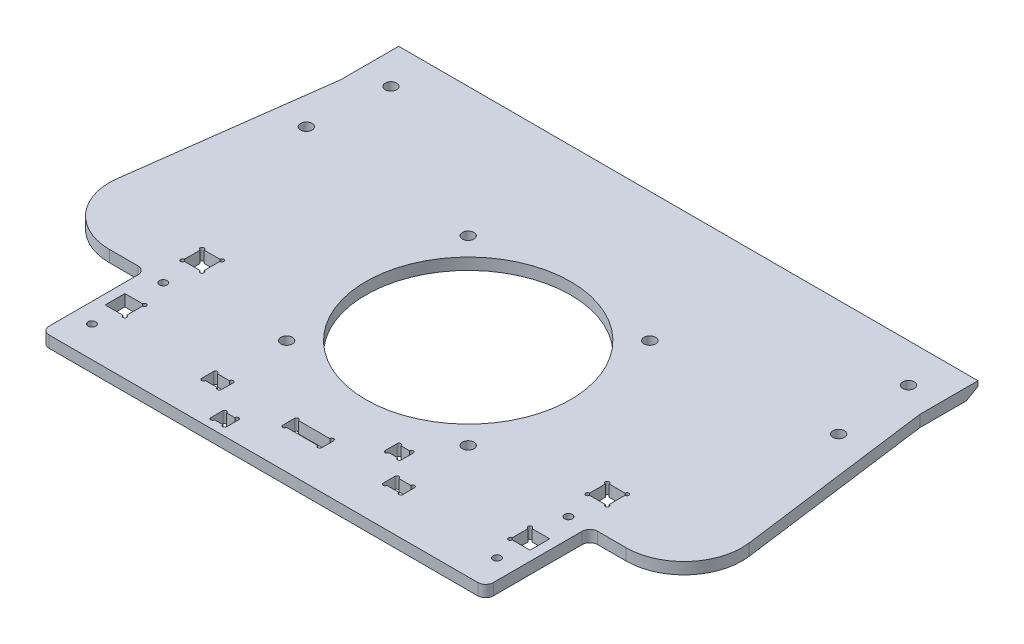
from build123d import *

# Parameters (mm, degrees)
SKETCH1_W           = 5.1
SKETCH1_H           = 5.1
BOSS_EXTRUDE1_DEPTH = 3
SKETCH2_R           = 26.5
SKETCH2_R_2         = 1.5
CUT_EXTRUDE1_DEPTH  = 3
FILLET1_R           = 15
SKETCH7_W           = 4.1
SKETCH7_H           = 3.1
SKETCH7_W_2         = 4.2
SKETCH7_W_3         = 5.1
SKETCH7_W_4         = 10.1
CUT_EXTRUDE4_DEPTH  = 10
CHAMFER1_SIZE       = 3
CHAMFER1_SIZE2      = 1.732050808
CUT_EXTRUDE5_DEPTH  = 10
SKETCH9_R           = 1
SKETCH9_R_2         = 1.5
CUT_EXTRUDE6_DEPTH  = 10
FILLET3_R           = 2


with BuildPart() as part:
    # Sketch1 → Boss-Extrude1 (new body)
    with BuildSketch(Plane(origin=(0, 0, 0), x_dir=(1, 0, 0), z_dir=(0, 1, 0))):
        Polygon((75, 95), (75, 110), (-75, 110), (-75, 95), (-84, 27), (-57.5, 27), (-57.5, 19.1), (-57.5, 14), (-57.5, 0), (57.5, 0), (57.5, 14), (57.5, 19.1), (57.5, 27), (84, 27), align=None)
        with Locations((52.45, 16.55)):
            Rectangle(SKETCH1_W, SKETCH1_H, mode=Mode.SUBTRACT)
        with Locations((52.45, 36.55)):
            Rectangle(SKETCH1_W, SKETCH1_H, mode=Mode.SUBTRACT)
        with Locations((-52.45, 16.55)):
            Rectangle(SKETCH1_W, SKETCH1_H, mode=Mode.SUBTRACT)
        with Locations((-52.45, 36.55)):
            Rectangle(SKETCH1_W, SKETCH1_H, mode=Mode.SUBTRACT)
    extrude(amount=BOSS_EXTRUDE1_DEPTH)

    # Sketch2 → Cut-Extrude1 (cut)
    with BuildSketch(Plane(origin=(0, 3, 0), x_dir=(1, 0, 0), z_dir=(0, 1, 0))):
        with Locations(Location((0, 53, 0), (0, 0, 270))):
            Circle(SKETCH2_R)
        with Locations(Location((23.511300474, 76.511300474, 0), (0, 0, 270))):
            Circle(SKETCH2_R_2)
        with Locations(Location((-23.511300474, 76.511300474, 0), (0, 0, 270))):
            Circle(SKETCH2_R_2)
        with Locations(Location((-23.511300474, 29.488699526, 0), (0, 0, 270))):
            Circle(SKETCH2_R_2)
        with Locations(Location((23.511300474, 29.488699526, 0), (0, 0, 270))):
            Circle(SKETCH2_R_2)
    extrude(amount=-CUT_EXTRUDE1_DEPTH, mode=Mode.SUBTRACT)

    # Fillet1
    fillet1_edges = [part.edges().sort_by_distance(p)[0] for p in [
        (-84, 1.5, -27),
        (84, 1.5, -27),
    ]]
    fillet(fillet1_edges, radius=FILLET1_R)

    # Sketch7 → Cut-Extrude4 (cut)
    with BuildSketch(Plane.XZ):
        with Locations((-14, -3.95)):
            Rectangle(SKETCH7_W, SKETCH7_H)
        with Locations((16, -19.15)):
            Rectangle(SKETCH7_W_2, SKETCH7_H)
        with Locations((-23.5, -11.55)):
            Rectangle(SKETCH7_W_3, SKETCH7_H)
        with Locations((23.5, -11.55)):
            Rectangle(SKETCH7_W_3, SKETCH7_H)
        with Locations((0, -11.55)):
            Rectangle(SKETCH7_W_4, SKETCH7_H)
    extrude(amount=-CUT_EXTRUDE4_DEPTH, mode=Mode.SUBTRACT)

    # Chamfer1
    chamfer1_edges = [part.edges().sort_by_distance(p)[0] for p in [
        (0, 0, -110),
    ]]
    chamfer1_side = [part.faces().sort_by_distance(p)[0] for p in [
        (76.421351958, 0, -69.225215197),
    ]]
    chamfer(chamfer1_edges, length=CHAMFER1_SIZE, length2=CHAMFER1_SIZE2, reference=chamfer1_side[0])

    # Sketch4 → Cut-Extrude5 (cut)
    with BuildSketch(Plane(origin=(0, 3, 0), x_dir=(1, 0, 0), z_dir=(0, 1, 0))):
        with BuildLine():
            Line((50.4, 39.1), (49.9, 39.1))
            Line((49.9, 39.1), (49.9, 38.6))
            ThreePointArc((49.9, 38.6), (49.546446609, 39.453553391), (50.4, 39.1))
        make_face()
        with BuildLine():
            ThreePointArc((54.5, 39.1), (55.353553391, 39.453553391), (55, 38.6))
            Line((55, 38.6), (55, 39.1))
            Line((55, 39.1), (54.5, 39.1))
        make_face()
        with BuildLine():
            ThreePointArc((55, 34.5), (55.353553391, 33.646446609), (54.5, 34))
            Line((54.5, 34), (55, 34))
            Line((55, 34), (55, 34.5))
        make_face()
        with BuildLine():
            Line((49.9, 34.5), (49.9, 34))
            Line((49.9, 34), (50.4, 34))
            ThreePointArc((50.4, 34), (49.546446609, 33.646446609), (49.9, 34.5))
        make_face()
        with BuildLine():
            Line((49.9, 19.1), (49.9, 18.6))
            ThreePointArc((49.9, 18.6), (49.546446609, 19.453553391), (50.4, 19.1))
            Line((50.4, 19.1), (49.9, 19.1))
        make_face()
        with BuildLine():
            ThreePointArc((49.9, 14.5), (49.546446609, 13.646446609), (50.4, 14))
            Line((50.4, 14), (49.9, 14))
            Line((49.9, 14), (49.9, 14.5))
        make_face()
        with BuildLine():
            ThreePointArc((13.9, 20.7), (14.4, 21.2), (14.9, 20.7))
            Line((14.9, 20.7), (13.9, 20.7))
        make_face()
        with BuildLine():
            ThreePointArc((18.1, 20.7), (17.6, 21.2), (17.1, 20.7))
            Line((17.1, 20.7), (18.1, 20.7))
        make_face()
        with BuildLine():
            ThreePointArc((18.1, 17.6), (17.6, 17.1), (17.1, 17.6))
            Line((17.1, 17.6), (18.1, 17.6))
        make_face()
        with BuildLine():
            ThreePointArc((13.9, 17.6), (14.4, 17.1), (14.9, 17.6))
            Line((14.9, 17.6), (13.9, 17.6))
        make_face()
        with BuildLine():
            ThreePointArc((20.95, 13.1), (21.45, 13.6), (21.95, 13.1))
            Line((21.95, 13.1), (20.95, 13.1))
        make_face()
        with BuildLine():
            ThreePointArc((26.05, 13.1), (25.55, 13.6), (25.05, 13.1))
            Line((25.05, 13.1), (26.05, 13.1))
        make_face()
        with BuildLine():
            ThreePointArc((26.05, 10), (25.55, 9.5), (25.05, 10))
            Line((25.05, 10), (26.05, 10))
        make_face()
        with BuildLine():
            ThreePointArc((20.95, 10), (21.45, 9.5), (21.95, 10))
            Line((21.95, 10), (20.95, 10))
        make_face()
        with BuildLine():
            ThreePointArc((5.05, 13.1), (4.55, 13.6), (4.05, 13.1))
            Line((4.05, 13.1), (5.05, 13.1))
        make_face()
        with BuildLine():
            ThreePointArc((5.05, 10), (4.55, 9.5), (4.05, 10))
            Line((4.05, 10), (5.05, 10))
        make_face()
        with BuildLine():
            ThreePointArc((-5.05, 13.1), (-4.55, 13.6), (-4.05, 13.1))
            Line((-4.05, 13.1), (-5.05, 13.1))
        make_face()
        with BuildLine():
            ThreePointArc((-5.05, 10), (-4.55, 9.5), (-4.05, 10))
            Line((-4.05, 10), (-5.05, 10))
        make_face()
        with BuildLine():
            ThreePointArc((-11.95, 5.5), (-12.45, 6), (-12.95, 5.5))
            Line((-12.95, 5.5), (-11.95, 5.5))
        make_face()
        with BuildLine():
            ThreePointArc((-11.95, 2.4), (-12.45, 1.9), (-12.95, 2.4))
            Line((-12.95, 2.4), (-11.95, 2.4))
        make_face()
        with BuildLine():
            ThreePointArc((-16.05, 2.4), (-15.55, 1.9), (-15.05, 2.4))
            Line((-15.05, 2.4), (-16.05, 2.4))
        make_face()
        with BuildLine():
            ThreePointArc((-16.05, 5.5), (-15.55, 6), (-15.05, 5.5))
            Line((-15.05, 5.5), (-16.05, 5.5))
        make_face()
        with BuildLine():
            ThreePointArc((-20.95, 10), (-21.45, 9.5), (-21.95, 10))
            Line((-21.95, 10), (-20.95, 10))
        make_face()
        with BuildLine():
            ThreePointArc((-20.95, 13.1), (-21.45, 13.6), (-21.95, 13.1))
            Line((-21.95, 13.1), (-20.95, 13.1))
        make_face()
        with BuildLine():
            ThreePointArc((-26.05, 13.1), (-25.55, 13.6), (-25.05, 13.1))
            Line((-25.05, 13.1), (-26.05, 13.1))
        make_face()
        with BuildLine():
            ThreePointArc((-26.05, 10), (-25.55, 9.5), (-25.05, 10))
            Line((-25.05, 10), (-26.05, 10))
        make_face()
        with BuildLine():
            Line((-49.9, 19.1), (-49.9, 18.6))
            ThreePointArc((-49.9, 18.6), (-49.546446609, 19.453553391), (-50.4, 19.1))
            Line((-50.4, 19.1), (-49.9, 19.1))
        make_face()
        with BuildLine():
            ThreePointArc((-49.9, 14.5), (-49.546446609, 13.646446609), (-50.4, 14))
            Line((-50.4, 14), (-49.9, 14))
            Line((-49.9, 14), (-49.9, 14.5))
        make_face()
        with BuildLine():
            ThreePointArc((-50.4, 39.1), (-49.546446609, 39.453553391), (-49.9, 38.6))
            Line((-49.9, 38.6), (-49.9, 39.1))
            Line((-49.9, 39.1), (-50.4, 39.1))
        make_face()
        with BuildLine():
            Line((-49.9, 34), (-50.4, 34))
            ThreePointArc((-50.4, 34), (-49.546446609, 33.646446609), (-49.9, 34.5))
            Line((-49.9, 34.5), (-49.9, 34))
        make_face()
        with BuildLine():
            ThreePointArc((-54.5, 39.1), (-55.353553391, 39.453553391), (-55, 38.6))
            Line((-55, 38.6), (-55, 39.1))
            Line((-55, 39.1), (-54.5, 39.1))
        make_face()
        with BuildLine():
            ThreePointArc((-55, 34.5), (-55.353553391, 33.646446609), (-54.5, 34))
            Line((-54.5, 34), (-55, 34))
            Line((-55, 34), (-55, 34.5))
        make_face()
    extrude(amount=-CUT_EXTRUDE5_DEPTH, mode=Mode.SUBTRACT)

    # Sketch9 → Cut-Extrude6 (cut)
    with BuildSketch(Plane(origin=(0, 3, 0), x_dir=(1, 0, 0), z_dir=(0, 1, 0))):
        with Locations(Location((52.45, 26.5, 0), (0, 0, 270))):
            Circle(SKETCH9_R)
        with Locations(Location((52.45, 8, 0), (0, 0, 270))):
            Circle(SKETCH9_R)
        with Locations(Location((67, 100, 0), (0, 0, 270))):
            Circle(SKETCH9_R_2)
        with Locations(Location((68.915529111, 80, 0), (0, 0, 270))):
            Circle(SKETCH9_R_2)
        with Locations(Location((-52.45, 8, 0), (0, 0, 90))):
            Circle(SKETCH9_R)
        with Locations(Location((-52.45, 26.5, 0), (0, 0, 90))):
            Circle(SKETCH9_R)
        with Locations(Location((-68.915529111, 80, 0), (0, 0, 90))):
            Circle(SKETCH9_R_2)
        with Locations(Location((-67, 100, 0), (0, 0, 90))):
            Circle(SKETCH9_R_2)
    extrude(amount=-CUT_EXTRUDE6_DEPTH, mode=Mode.SUBTRACT)

    # Fillet3
    fillet3_edges = [part.edges().sort_by_distance(p)[0] for p in [
        (57.5, 1.5, 0),
        (-57.5, 1.5, 0),
        (-57.5, 1.5, -27),
        (57.5, 1.5, -27),
    ]]
    fillet(fillet3_edges, radius=FILLET3_R)


solid = part.part
